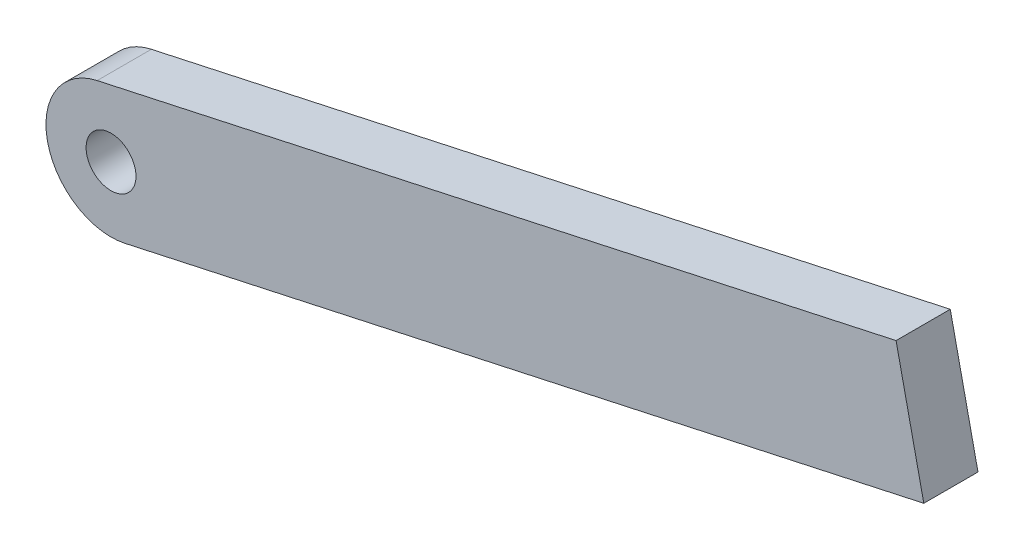
from build123d import *

# Parameters (mm, degrees)
SKETCH2_R           = 3.81
BOSS_EXTRUDE1_DEPTH = 3.175
SKETCH3_R           = 1.4605
CUT_EXTRUDE1_DEPTH  = 3.175


with BuildPart() as part:
    # Sketch2 → Boss-Extrude1 (new body)
    with BuildSketch(Plane.XY):
        with Locations((193.674999999, 14.287500001)):
            Circle(SKETCH2_R)
        Polygon((192.86290311, 18.009945251), (194.487096888, 10.56505475), (241.287043978, 20.775034718), (239.6628502, 28.219925218), align=None)
    extrude(amount=BOSS_EXTRUDE1_DEPTH)

    # Sketch3 → Cut-Extrude1 (cut)
    with BuildSketch(Plane.XY.offset(3.175)):
        with Locations((193.674999999, 14.287500001)):
            Circle(SKETCH3_R)
    extrude(amount=-CUT_EXTRUDE1_DEPTH, mode=Mode.SUBTRACT)


solid = part.part
